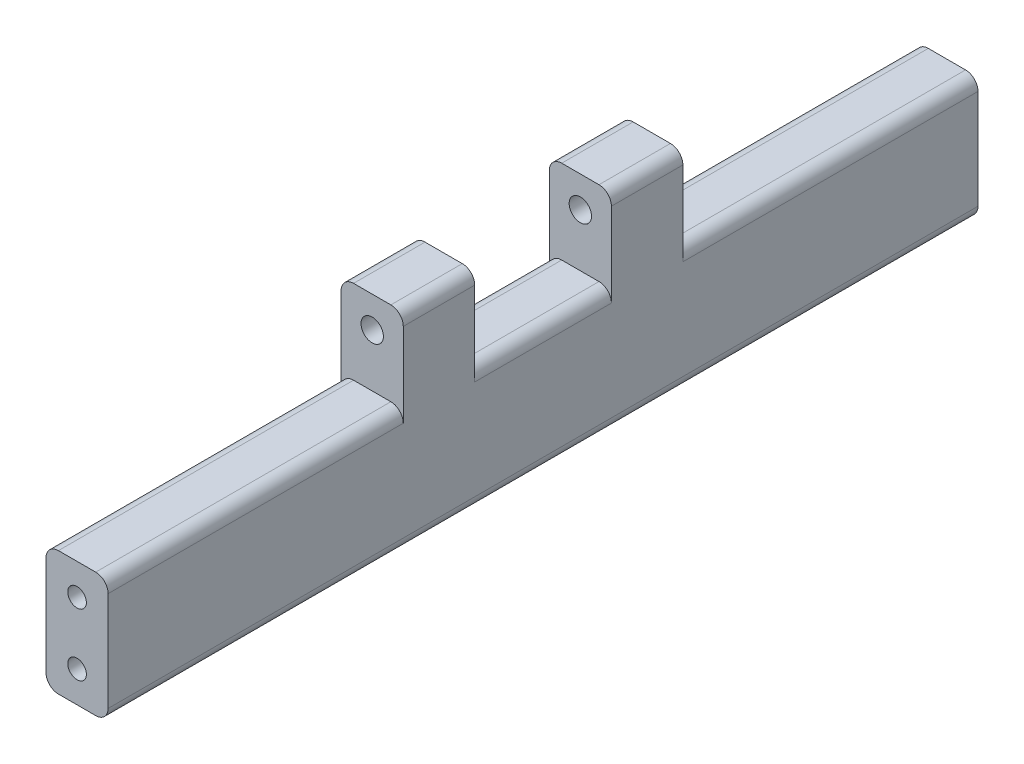
from build123d import *

# Parameters (mm, degrees)
SKETCH1_W           = 12.7
SKETCH1_H           = 12.7
SKETCH1_R           = 1.905
BOSS_EXTRUDE1_DEPTH = 88.9
SKETCH3_W           = 12.7
SKETCH3_H           = 17.145
SKETCH3_R           = 2.286
BOSS_EXTRUDE2_DEPTH = 28.575
SKETCH4_W           = 12.7
SKETCH4_H           = 17.145
CUT_EXTRUDE1_DEPTH  = 13.97
FILLET1_R           = 2.54


with BuildPart() as part:
    # Sketch1 → Boss-Extrude1 (new, symmetric)
    # profile 1 of 2: a face of its own
    with BuildSketch(Plane.XY):
        with Locations((-6.35, -6.35)):
            Rectangle(SKETCH1_W, SKETCH1_H)
        with Locations((-6.35, -6.35)):
            Circle(SKETCH1_R, mode=Mode.SUBTRACT)
    # profile 2 of 2: a face of its own
    with BuildSketch(Plane.XY):
        with Locations((-6.35, 6.35)):
            Rectangle(SKETCH1_W, SKETCH1_H)
        with Locations((-6.35, 6.35)):
            Circle(SKETCH1_R, mode=Mode.SUBTRACT)
    extrude(amount=BOSS_EXTRUDE1_DEPTH, both=True)

    # Sketch3 → Boss-Extrude2 (add, symmetric)
    with BuildSketch(Plane.XY):
        with Locations((-6.35, 21.2725)):
            Rectangle(SKETCH3_W, SKETCH3_H)
        with Locations((-6.35, 23.495)):
            Circle(SKETCH3_R, mode=Mode.SUBTRACT)
    extrude(amount=BOSS_EXTRUDE2_DEPTH, both=True)

    # Sketch4 → Cut-Extrude1 (cut, symmetric)
    with BuildSketch(Plane.XY):
        with Locations((-6.35, 21.2725)):
            Rectangle(SKETCH4_W, SKETCH4_H)
    extrude(amount=CUT_EXTRUDE1_DEPTH, both=True, mode=Mode.SUBTRACT)

    # Fillet1
    fillet1_edges = [part.edges().sort_by_distance(p)[0] for p in [
        (0, -12.7, 0),
        (-12.7, -12.7, 0),
        (-12.7, 12.7, -58.7375),
        (0, 12.7, -58.7375),
        (0, 12.7, 58.7375),
        (-12.7, 12.7, 58.7375),
        (0, 29.845, 21.2725),
        (-12.7, 29.845, 21.2725),
        (-12.7, 29.845, -21.2725),
        (0, 29.845, -21.2725),
        (-12.7, 12.7, 0),
        (0, 12.7, 0),
    ]]
    fillet(fillet1_edges, radius=FILLET1_R)


solid = part.part
